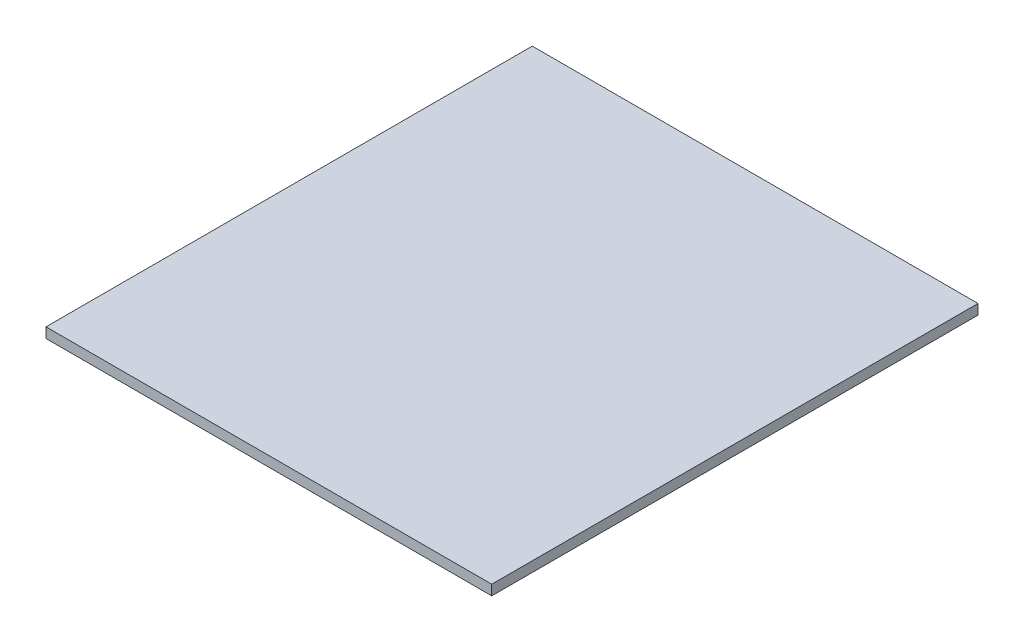
from build123d import *

# Parameters (mm, degrees)
SKETCH1_W           = 279.4
SKETCH1_H           = 304.8
BOSS_EXTRUDE1_DEPTH = 6.35


with BuildPart() as part:
    # Sketch1 → Boss-Extrude1 (new body)
    with BuildSketch(Plane(origin=(0, 0, 0), x_dir=(1, 0, 0), z_dir=(0, 1, 0))):
        Rectangle(SKETCH1_W, SKETCH1_H)
    extrude(amount=BOSS_EXTRUDE1_DEPTH)


solid = part.part
